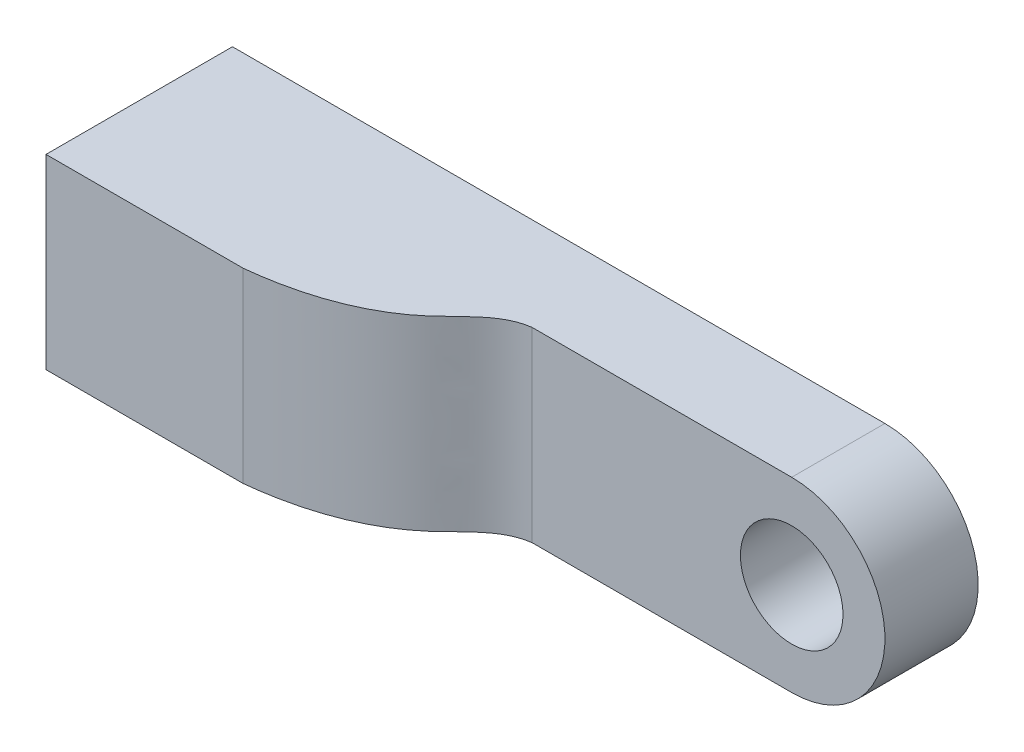
from build123d import *

# Parameters (mm, degrees)
SKETCH_2_R          = 1.100000024
EXTRUDE_1_DEPTH     = 4
SKETCH_4_R          = 1
CUT_EXTRUDE_1_DEPTH = 5
CUT_EXTRUDE_2_DEPTH = 5


with BuildPart() as part:
    # 草图2 → 凸台-拉伸1 (new body)
    with BuildSketch(Plane.XY):
        with BuildLine():
            Line((5.998458769, 1.854285714), (-7.998458769, 1.854285714))
            Line((-7.998458769, 1.854285714), (-7.998458769, -2.145714286))
            Line((-7.998458769, -2.145714286), (5.998458769, -2.145714286))
            ThreePointArc((5.998458769, -2.145714286), (7.998458769, -0.145714286), (5.998458769, 1.854285714))
        make_face()
        with Locations((5.998458956, -0.145714128)):
            Circle(SKETCH_2_R, mode=Mode.SUBTRACT)
    extrude(amount=EXTRUDE_1_DEPTH)

    # 草图4 → 切除-拉伸1 (cut)
    with BuildSketch(Plane.ZY.offset(7.998458769)):
        with Locations((2, -0.145714286)):
            Circle(SKETCH_4_R)
    extrude(amount=-CUT_EXTRUDE_1_DEPTH, mode=Mode.SUBTRACT)

    # 草图6 → 切除-拉伸2 (cut)
    with BuildSketch(Plane(origin=(0, 1.854285714, 0), x_dir=(1, 0, 0), z_dir=(0, 1, 0))):
        with BuildLine():
            Line((0.430237449, -2), (8.42228294, -2))
            Line((8.42228294, -2), (8.42228294, -4.483544919))
            Line((8.42228294, -4.483544919), (-3.767400724, -4))
            add(Edge.make_bspline(
                [(-3.767400724, -4), (-2.756163947, -3.891783592), (-1.123117091, -3.429006158), (-0.148462867, -2.077202756), (0.430237449, -2)],
                knots=[0, 0, 0, 0, 0.656759568, 1, 1, 1, 1], degree=3))
        make_face()
    extrude(amount=-CUT_EXTRUDE_2_DEPTH, mode=Mode.SUBTRACT)


solid = part.part
